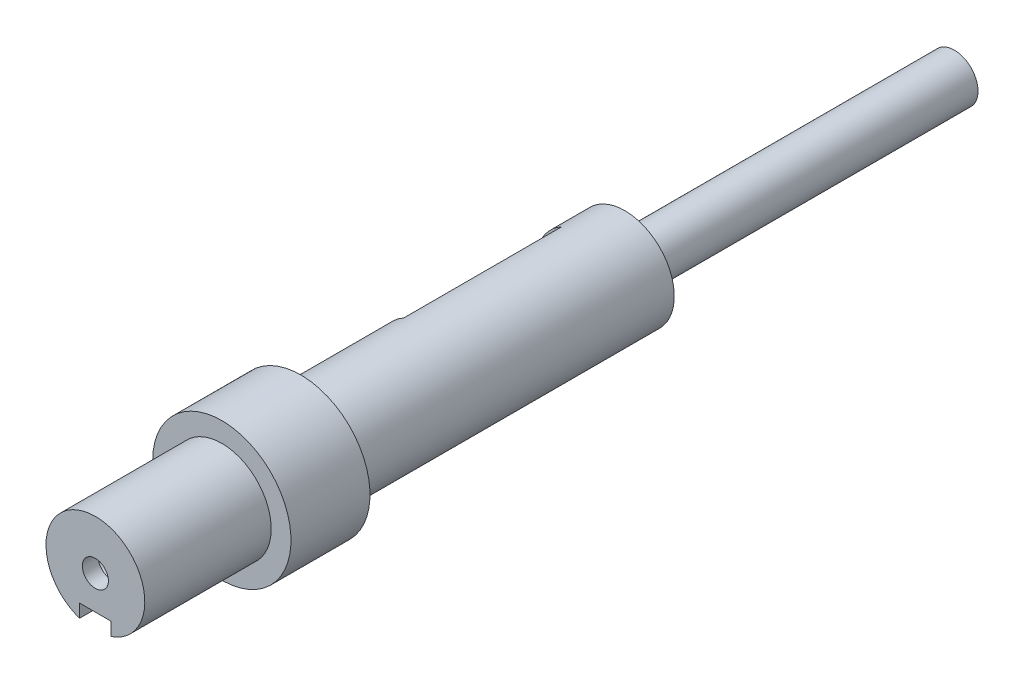
from build123d import *
from build123d.topology import SkipClean

# Parameters (mm, degrees)
ESQUISSE1_R                                = 30
BOSS_EXTRU_1_DEPTH                         = 15
ESQUISSE2_R                                = 12.5
BOSS_EXTRU_2_DEPTH                         = 124
ESQUISSE4_2_W                              = 230
ESQUISSE4_2_H                              = 40
ENL_V_MAT_EXTRU_1_DEPTH                    = 5
CHAMBRAGE_POUR_VIS_T_TE_HEXAGONALE_2_COUNT = 2
CHAMBRAGE_POUR_VIS_T_TE_HEXAGONALE_2_PITCH = 41
ESQUISSE17_R                               = 6
BOSS_EXTRU_4_DEPTH                         = 83.38
ESQUISSE18_W                               = 10.356322474
ESQUISSE18_H                               = 3
ENL_V_MAT_EXTRU_2_DEPTH                    = 3
ESQUISSE19_W                               = 7.933443835
ESQUISSE19_H                               = 21.9317122
ENL_V_MAT_EXTRU_3_DEPTH                    = 50
BOSS_EXTRU_6_START                         = -10
ESQUISSE21_R                               = 12.5
BOSS_EXTRU_6_DEPTH                         = 10
D_GAGEMENT_M41_D                           = 4.5
D_GAGEMENT_M41_DEPTH                       = 3
D_GAGEMENT_M41_TIP                         = 1.299038106
ESQUISSE26_R                               = 17.5
BOSS_EXTRU_8_DEPTH                         = 52
ENL_V_START                                = -32
ESQUISSE27_R                               = 17.5
ENL_V_MAT_EXTRU_5_DEPTH                    = 32
ENL_V_START_2                              = -15
ESQUISSE28_R                               = 30
ENL_V_MAT_EXTRU_6_DEPTH                    = 15
BOSS_EXTRU_9_START                         = 10
BOSS_EXTRU_9_DEPTH                         = 10
D_GAGEMENT_M61_D                           = 6.6
D_GAGEMENT_M61_DEPTH                       = 4
D_GAGEMENT_M61_TIP                         = 1.905255888


with BuildPart() as part:
    # Esquisse1 → Boss.-Extru.1 (new body)
    with BuildSketch(Plane.XY):
        Circle(ESQUISSE1_R)
    extrude(amount=BOSS_EXTRU_1_DEPTH)

    # Esquisse2 → Boss.-Extru.2 (add)
    with BuildSketch(Plane(origin=(0, 0, 0), x_dir=(-1, 0, 0), z_dir=(0, 0, -1))):
        Circle(ESQUISSE2_R)
    extrude(amount=BOSS_EXTRU_2_DEPTH)

    # Esquisse4<2> → Enlèv. mat.-Extru.1 (cut)
    with BuildSketch(Plane.XY.offset(15)):
        Rectangle(ESQUISSE4_2_W, ESQUISSE4_2_H)
    extrude(amount=-ENL_V_MAT_EXTRU_1_DEPTH, mode=Mode.SUBTRACT)

    # Esquisse14 → Chambrage pour vis à tête hexagonale M51 (revolve, cut)
    with BuildSketch(Plane.YZ.offset(-20.5)):
        Polygon((0, 0), (0, 15), (2.75, 15), (2.75, 3.605), (2.775, 3.58), (6.12, 3.58), (6.12, 0), align=None)
    chambrage_pour_vis_t_te_hexagonale_m51 = revolve(axis=Axis((-20.5, 0, -6.35), (0, 0, 1)), mode=Mode.SUBTRACT)

    # Chambrage pour vis _ t_te hexagonale 2: Chambrage pour vis à tête hexagonale M51 ×2
    with Locations(*[(i * CHAMBRAGE_POUR_VIS_T_TE_HEXAGONALE_2_PITCH, 0, 0) for i in range(1, CHAMBRAGE_POUR_VIS_T_TE_HEXAGONALE_2_COUNT)]):
        add(chambrage_pour_vis_t_te_hexagonale_m51, mode=Mode.SUBTRACT)

    # Esquisse17 → Boss.-Extru.4 (add)
    with BuildSketch(Plane(origin=(0, 0, -124), x_dir=(-1, 0, 0), z_dir=(0, 0, -1))):
        Circle(ESQUISSE17_R)
    extrude(amount=BOSS_EXTRU_4_DEPTH)

    # Esquisse18 → Enlèv. mat.-Extru.2 (cut)
    with BuildSketch(Plane(origin=(0, 0, -207.38), x_dir=(-1, 0, 0), z_dir=(0, 0, -1))):
        with Locations((1.787207702, 0)):
            Rectangle(ESQUISSE18_W, ESQUISSE18_H)
    extrude(amount=-ENL_V_MAT_EXTRU_2_DEPTH, mode=Mode.SUBTRACT)

    # Esquisse19 → Enlèv. mat.-Extru.3 (cut)
    with BuildSketch(Plane(origin=(0, 0, -124), x_dir=(-1, 0, 0), z_dir=(0, 0, -1))):
        with Locations((9.966721917, 0)):
            Rectangle(ESQUISSE19_W, ESQUISSE19_H)
    extrude(amount=-ENL_V_MAT_EXTRU_3_DEPTH, mode=Mode.SUBTRACT)

    # Esquisse21 → Boss.-Extru.6 (add)
    with BuildSketch(Plane(origin=(0, 0, -124), x_dir=(-1, 0, 0), z_dir=(0, 0, -1)).offset(BOSS_EXTRU_6_START)):
        Circle(ESQUISSE21_R)
    extrude(amount=BOSS_EXTRU_6_DEPTH)

    # Dégagement M41
    with Locations(Plane.ZY.offset(6)):
        with Locations((-82.1, 5.85067254), (-93.1, -2.14932746), (-93.1, 5.85067254), (-104.1, 5.85067254)):
            Hole(D_GAGEMENT_M41_D / 2, depth=D_GAGEMENT_M41_DEPTH)
            with Locations((0, 0, -(D_GAGEMENT_M41_DEPTH + D_GAGEMENT_M41_TIP / 2))):  # 120° drill point
                Cone(0, D_GAGEMENT_M41_D / 2, D_GAGEMENT_M41_TIP, mode=Mode.SUBTRACT)

    # Esquisse26 → Boss.-Extru.8 (add)
    with BuildSketch(Plane(origin=(0, 0, -74), x_dir=(-1, 0, 0), z_dir=(0, 0, -1))):
        Circle(ESQUISSE26_R)
    extrude(amount=-BOSS_EXTRU_8_DEPTH)

    # Esquisse27 → Enlèv. mat.-Extru.5 (cut)
    with BuildSketch(Plane(origin=(0, 0, -74), x_dir=(-1, 0, 0), z_dir=(0, 0, -1)).offset(ENL_V_START)):
        Circle(ESQUISSE27_R)
        with BuildLine():
            ThreePointArc((6, 10.9658561), (10.752906584, 6.373774392), (12.5, 0))
            ThreePointArc((12.5, 0), (10.752906584, -6.373774392), (6, -10.9658561))
            ThreePointArc((6, -10.9658561), (-12.5, 0), (6, 10.9658561))
        make_face(mode=Mode.SUBTRACT)
    extrude(amount=ENL_V_MAT_EXTRU_5_DEPTH, mode=Mode.SUBTRACT)

    # Esquisse28 → Enlèv. mat.-Extru.6 (cut)
    with BuildSketch(Plane.XY.offset(15).offset(ENL_V_START_2)):
        Circle(ESQUISSE28_R)
    extrude(amount=ENL_V_MAT_EXTRU_6_DEPTH, mode=Mode.SUBTRACT)

    # Esquisse29 → Boss.-Extru.9 (add)
    with SkipClean():  # the faces are left unmerged after this step: merging them gives an invalid solid
        with BuildSketch(Plane.XY.offset(BOSS_EXTRU_9_START)):
            with BuildLine():
                Line((-4, -11.842719282), (-4, -8.5))
                Line((-4, -8.5), (4, -8.5))
                Line((4, -8.5), (4, -11.842719282))
                ThreePointArc((4, -11.842719282), (10.155048006, -7.288689869), (12.5, 0))
                ThreePointArc((12.5, 0), (-7.288689869, 10.155048006), (-4, -11.842719282))
            make_face()
        extrude(amount=-BOSS_EXTRU_9_DEPTH)

    # Dégagement M61
    with Locations(Plane.XY.offset(10)):
        with Locations((0, 0)):
            Hole(D_GAGEMENT_M61_D / 2, depth=D_GAGEMENT_M61_DEPTH)
            with Locations((0, 0, -(D_GAGEMENT_M61_DEPTH + D_GAGEMENT_M61_TIP / 2))):  # 120° drill point
                Cone(0, D_GAGEMENT_M61_D / 2, D_GAGEMENT_M61_TIP, mode=Mode.SUBTRACT)


solid = part.part
